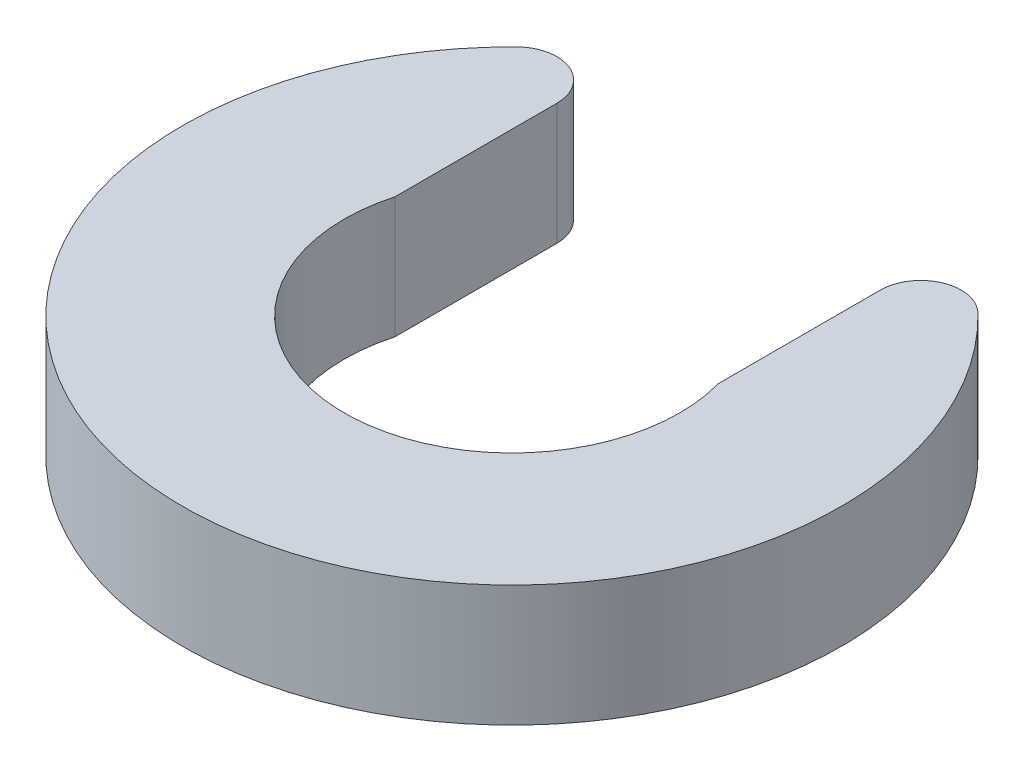
from build123d import *

# Parameters (mm, degrees)
BOSS_EXTRUDE1_DEPTH = 3
FILLET1_R           = 1


with BuildPart() as part:
    # Sketch1 → Boss-Extrude1 (new body)
    with BuildSketch(Plane(origin=(0, 0, 0), x_dir=(1, 0, 0), z_dir=(0, 1, 0))):
        with BuildLine():
            ThreePointArc((8.15, 0), (7.036423097, 4.112329024), (4, 7.100880227))
            Line((4, 7.100880227), (4, 1.105667219))
            ThreePointArc((4, 1.105667219), (4.112329024, 0.55789784), (4.15, 0))
            ThreePointArc((4.15, 0), (-0.55789784, -4.112329024), (-4, 1.105667219))
            Line((-4, 1.105667219), (-4, 7.100880227))
            ThreePointArc((-4, 7.100880227), (-4.112329024, -7.036423097), (8.15, 0))
        make_face()
    extrude(amount=BOSS_EXTRUDE1_DEPTH)

    # Fillet1
    fillet1_edges = [part.edges().sort_by_distance(p)[0] for p in [
        (4, 1.5, -7.100880227),
        (-4, 1.5, -7.100880227),
    ]]
    fillet(fillet1_edges, radius=FILLET1_R)


solid = part.part
